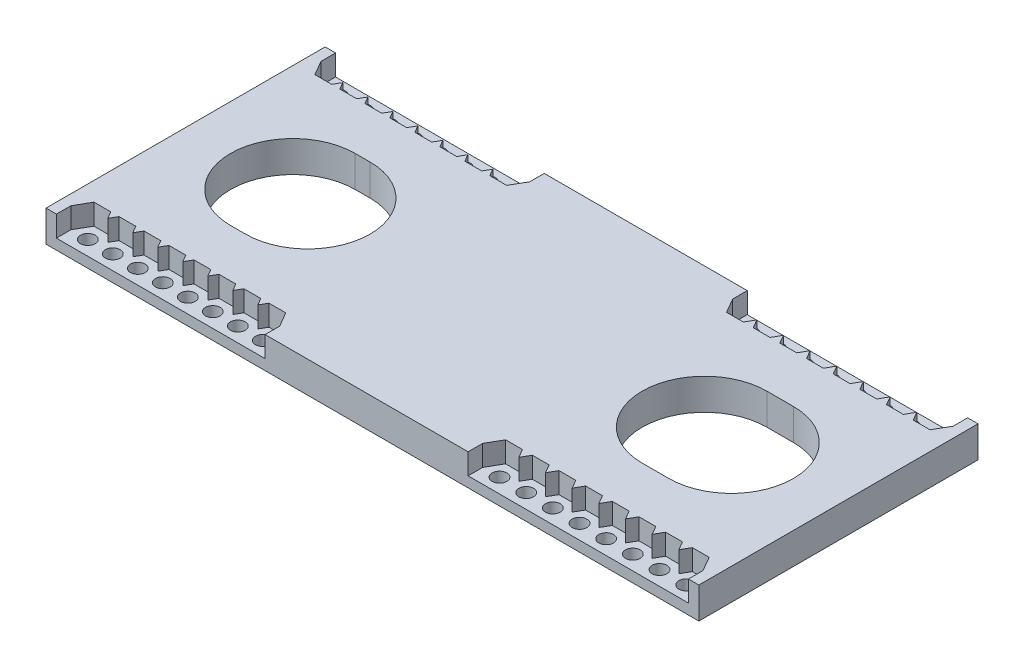
from build123d import *

# Parameters (mm, degrees)
SKETCH1_W           = 198.979955438
SKETCH1_H           = 42.541825
SKETCH1_R           = 2.2479
BOSS_EXTRUDE1_DEPTH = 9.525
SKETCH1_5_R         = 2.2479
CUT_EXTRUDE1_DEPTH  = 6.35
CUT_EXTRUDE2_DEPTH  = 196.596168108


with BuildPart() as part:
    # Sketch1 → Boss-Extrude1 (new body)
    with BuildSketch(Plane(origin=(0, 0, 0), x_dir=(1, 0, 0), z_dir=(0, 1, 0))):
        with Locations((91.186, 21.2709125)):
            Rectangle(SKETCH1_W, SKETCH1_H)
        with Locations(Location((45.72, 38.1, 0), (0, 0, 270))):
            Circle(SKETCH1_R, mode=Mode.SUBTRACT)
        with Locations(Location((38.1, 38.1, 0), (0, 0, 270))):
            Circle(SKETCH1_R, mode=Mode.SUBTRACT)
        with Locations(Location((30.48, 38.1, 0), (0, 0, 270))):
            Circle(SKETCH1_R, mode=Mode.SUBTRACT)
        with Locations(Location((22.86, 38.1, 0), (0, 0, 270))):
            Circle(SKETCH1_R, mode=Mode.SUBTRACT)
        with Locations(Location((15.24, 38.1, 0), (0, 0, 270))):
            Circle(SKETCH1_R, mode=Mode.SUBTRACT)
        with Locations(Location((7.62, 38.1, 0), (0, 0, 270))):
            Circle(SKETCH1_R, mode=Mode.SUBTRACT)
        with Locations(Location((0, 38.1, 0), (0, 0, 270))):
            Circle(SKETCH1_R, mode=Mode.SUBTRACT)
        with Locations(Location((53.34, 38.1, 0), (0, 0, 270))):
            Circle(SKETCH1_R, mode=Mode.SUBTRACT)
        with Locations(Location((157.988, 38.1, 0), (0, 0, 270))):
            Circle(SKETCH1_R, mode=Mode.SUBTRACT)
        with Locations(Location((149.86, 38.1, 0), (0, 0, 270))):
            Circle(SKETCH1_R, mode=Mode.SUBTRACT)
        with Locations(Location((141.732, 38.1, 0), (0, 0, 270))):
            Circle(SKETCH1_R, mode=Mode.SUBTRACT)
        with Locations(Location((133.604, 38.1, 0), (0, 0, 270))):
            Circle(SKETCH1_R, mode=Mode.SUBTRACT)
        with Locations(Location((125.476, 38.1, 0), (0, 0, 270))):
            Circle(SKETCH1_R, mode=Mode.SUBTRACT)
        with Locations(Location((166.116, 38.1, 0), (0, 0, 270))):
            Circle(SKETCH1_R, mode=Mode.SUBTRACT)
        with Locations(Location((174.244, 38.1, 0), (0, 0, 270))):
            Circle(SKETCH1_R, mode=Mode.SUBTRACT)
        with Locations(Location((182.372, 38.1, 0), (0, 0, 270))):
            Circle(SKETCH1_R, mode=Mode.SUBTRACT)
    extrude(amount=-BOSS_EXTRUDE1_DEPTH)

    # Sketch1<5> → Cut-Extrude1 (cut)
    # profile 1 of 2: a face of its own
    with BuildSketch(Plane(origin=(0, 0, 0), x_dir=(1, 0, 0), z_dir=(0, 1, 0))):
        Polygon((-5.128977719, 38.1), (-2.564488859, 33.658175), (2.564488859, 33.658175), (3.81, 35.815463577), (5.055511141, 33.658175), (10.184488859, 33.658175), (11.43, 35.815463577), (12.675511141, 33.658175), (17.804488859, 33.658175), (19.05, 35.815463577), (20.295511141, 33.658175), (25.424488859, 33.658175), (26.67, 35.815463577), (27.915511141, 33.658175), (33.044488859, 33.658175), (34.29, 35.815463577), (35.535511141, 33.658175), (40.664488859, 33.658175), (41.91, 35.815463577), (43.155511141, 33.658175), (48.284488859, 33.658175), (49.53, 35.815463577), (50.775511141, 33.658175), (55.904488859, 33.658175), (58.468977719, 38.1), (58.468977719, 42.541825), (-5.128977719, 42.541825), align=None)
        with Locations((0, 38.1)):
            Circle(SKETCH1_5_R, mode=Mode.SUBTRACT)
        with Locations((7.62, 38.1)):
            Circle(SKETCH1_5_R, mode=Mode.SUBTRACT)
        with Locations((15.24, 38.1)):
            Circle(SKETCH1_5_R, mode=Mode.SUBTRACT)
        with Locations((22.86, 38.1)):
            Circle(SKETCH1_5_R, mode=Mode.SUBTRACT)
        with Locations((30.48, 38.1)):
            Circle(SKETCH1_5_R, mode=Mode.SUBTRACT)
        with Locations((38.1, 38.1)):
            Circle(SKETCH1_5_R, mode=Mode.SUBTRACT)
        with Locations((45.72, 38.1)):
            Circle(SKETCH1_5_R, mode=Mode.SUBTRACT)
        with Locations((53.34, 38.1)):
            Circle(SKETCH1_5_R, mode=Mode.SUBTRACT)
    # profile 2 of 2: a face of its own
    with BuildSketch(Plane(origin=(0, 0, 0), x_dir=(1, 0, 0), z_dir=(0, 1, 0))):
        Polygon((179.807511141, 33.658175), (184.936488859, 33.658175), (187.500977719, 38.1), (187.500977719, 42.541825), (120.347022281, 42.541825), (120.347022281, 38.1), (122.911511141, 33.658175), (128.040488859, 33.658175), (129.54, 36.255404482), (131.039511141, 33.658175), (136.168488859, 33.658175), (137.668, 36.255404482), (139.167511141, 33.658175), (144.296488859, 33.658175), (145.796, 36.255404482), (147.295511141, 33.658175), (152.424488859, 33.658175), (153.924, 36.255404482), (155.423511141, 33.658175), (160.552488859, 33.658175), (162.052, 36.255404482), (163.551511141, 33.658175), (168.680488859, 33.658175), (170.18, 36.255404482), (171.679511141, 33.658175), (176.808488859, 33.658175), (178.308, 36.255404482), align=None)
        with Locations((125.476, 38.1)):
            Circle(SKETCH1_5_R, mode=Mode.SUBTRACT)
        with Locations((133.604, 38.1)):
            Circle(SKETCH1_5_R, mode=Mode.SUBTRACT)
        with Locations((141.732, 38.1)):
            Circle(SKETCH1_5_R, mode=Mode.SUBTRACT)
        with Locations((149.86, 38.1)):
            Circle(SKETCH1_5_R, mode=Mode.SUBTRACT)
        with Locations((157.988, 38.1)):
            Circle(SKETCH1_5_R, mode=Mode.SUBTRACT)
        with Locations((166.116, 38.1)):
            Circle(SKETCH1_5_R, mode=Mode.SUBTRACT)
        with Locations((174.244, 38.1)):
            Circle(SKETCH1_5_R, mode=Mode.SUBTRACT)
        with Locations((182.372, 38.1)):
            Circle(SKETCH1_5_R, mode=Mode.SUBTRACT)
    extrude(amount=-CUT_EXTRUDE1_DEPTH, mode=Mode.SUBTRACT)

    # Mirror1: part across plane


with BuildPart() as part_1:
    add(part.part)
    add(part.part.mirror(Plane.XY))

    # Sketch2 → Cut-Extrude2 (cut, through all)
    with BuildSketch(Plane(origin=(0, 0, 0), x_dir=(1, 0, 0), z_dir=(0, 1, 0))):
        with BuildLine():
            Line((157.988, -19), (149.86, -19))
            ThreePointArc((149.86, -19), (130.86, 0), (149.86, 19))
            Line((149.86, 19), (157.988, 19))
            ThreePointArc((157.988, 19), (176.988, 0), (157.988, -19))
        make_face()
        with BuildLine():
            Line((28.956, -19), (24.384, -19))
            ThreePointArc((24.384, -19), (5.384, 0), (24.384, 19))
            Line((24.384, 19), (28.956, 19))
            ThreePointArc((28.956, 19), (47.956, 0), (28.956, -19))
        make_face()
    extrude(amount=-CUT_EXTRUDE2_DEPTH, mode=Mode.SUBTRACT)


solid = part_1.part
